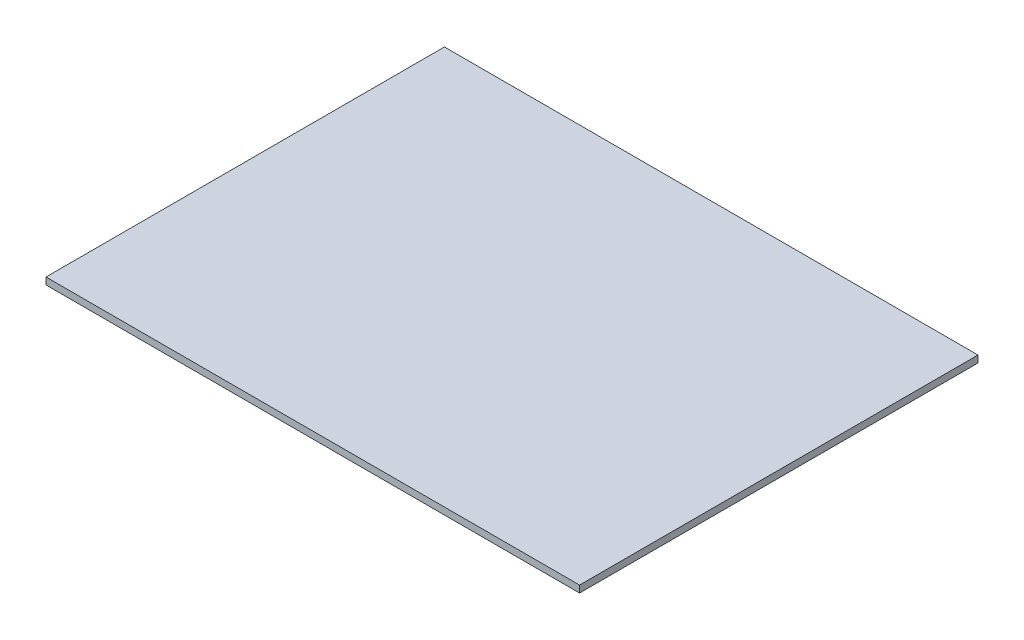
from build123d import *

# Parameters (mm, degrees)
SKETCH_1_W      = 308
SKETCH_1_H      = 230
EXTRUDE_1_DEPTH = 4


with BuildPart() as part:
    # Эскиз1 → Бобышка-Вытянуть1 (new body)
    with BuildSketch(Plane(origin=(0, 0, 0), x_dir=(1, 0, 0), z_dir=(0, 1, 0))):
        with Locations((-75.24556962, -31.372151899)):
            Rectangle(SKETCH_1_W, SKETCH_1_H)
    extrude(amount=EXTRUDE_1_DEPTH)


solid = part.part
